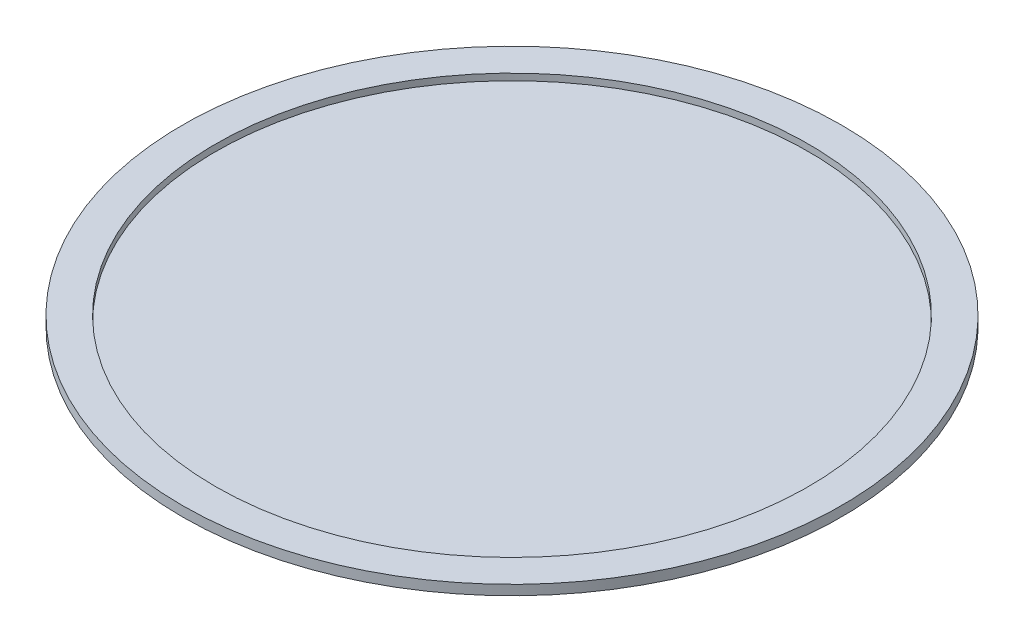
from build123d import *

# Parameters (mm, degrees)
SKETCH1_R           = 100
BOSS_EXTRUDE1_DEPTH = 3
SKETCH2_R           = 90
CUT_EXTRUDE1_DEPTH  = 2


with BuildPart() as part:
    # Sketch1 → Boss-Extrude1 (new body)
    with BuildSketch(Plane(origin=(0, 0, 0), x_dir=(1, 0, 0), z_dir=(0, 1, 0))):
        with Locations(Location((0, 0, 0), (0, 0, 270))):
            Circle(SKETCH1_R)
    extrude(amount=BOSS_EXTRUDE1_DEPTH)

    # Sketch2 → Cut-Extrude1 (cut)
    with BuildSketch(Plane(origin=(0, 3, 0), x_dir=(1, 0, 0), z_dir=(0, 1, 0))):
        with Locations(Location((0, 0, 0), (0, 0, 270))):
            Circle(SKETCH2_R)
    extrude(amount=-CUT_EXTRUDE1_DEPTH, mode=Mode.SUBTRACT)


solid = part.part
